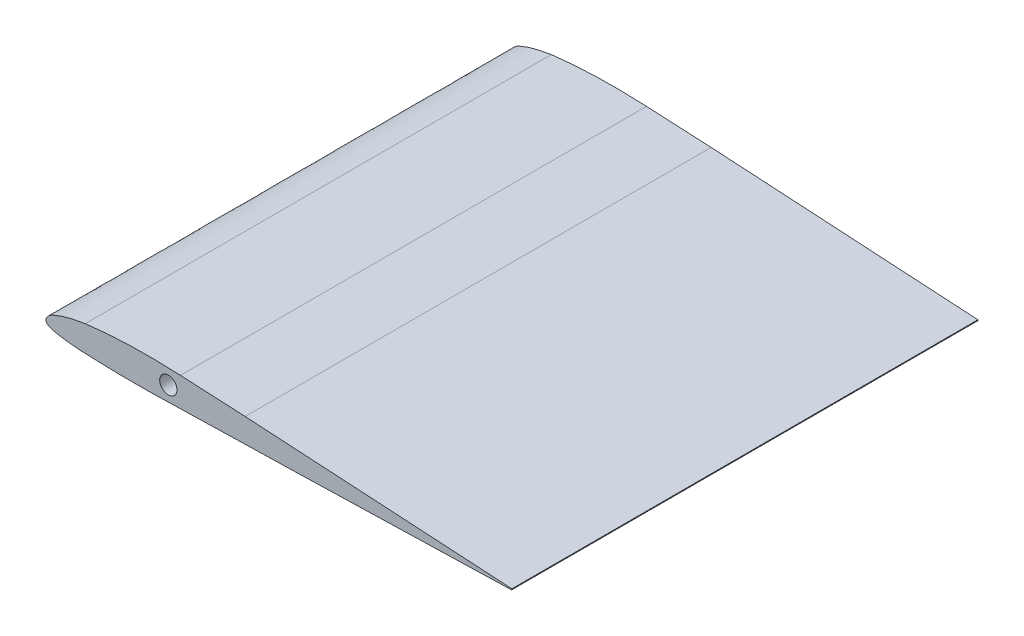
from build123d import *

# Parameters (mm, degrees)
AIRFOIL_DEPTH        = 203.2
CAMERA_CHANNEL_REACH = 289.922
SKETCH8_R            = 3.7592


with BuildPart() as part:
    # Sketch3 → Airfoil (new body)
    with BuildSketch(Plane.XY):
        with BuildLine():
            Line((202.994130812, 8.658655976), (110.583708873, 6.155294174))
            Line((110.583708873, 6.155294174), (45.243748526, 4.547671469))
            add(Edge.make_bspline(
                [(45.243748526, 4.547671469), (38.923572392, 4.568921268), (32.598685078, 4.437436548), (26.283676376, 4.693840567), (22.348358646, 4.853623607), (18.410196386, 4.937297779), (14.474878656, 5.097080819), (14.412947754, 5.099595357), (14.370093626, 5.173356562), (14.308475425, 5.180061537), (13.757234945, 5.240044692), (0.092319138, 5.933082267), (0.001596992, 8.740633601), (-0.083348667, 11.369421688), (3.240638559, 12.597933624), (5.152498304, 13.319770824), (6.702595853, 13.905021952), (8.281848193, 14.426252138), (9.890881707, 14.821641117), (12.262560893, 15.404435574), (14.691150833, 15.883501489), (17.149620686, 16.274957356)],
                knots=[0, 0, 0, 0, 1, 1, 1, 2, 2, 2, 3, 3, 3, 4, 4, 4, 5, 5, 5, 6, 6, 6, 6.272168289, 6.272168289, 6.272168289, 6.272168289], degree=3))
            add(Edge.make_bspline(
                [(17.149620686, 16.274957356), (28.832499255, 17.725653279), (42.670326445, 18.291936138), (58.641329464, 17.491030382)],
                knots=[0, 0, 0, 0, 1, 1, 1, 1], degree=3))
            Line((58.641329464, 17.491030382), (86.846468464, 16.076613382))
            Line((86.846468464, 16.076613382), (160.978559464, 11.666960382))
            Line((160.978559464, 11.666960382), (203.160688074, 9.157810196))
            ThreePointArc((203.160688074, 9.157810196), (203.180787666, 8.873737948), (202.994130812, 8.658655976))
        make_face()
    extrude(amount=AIRFOIL_DEPTH)

    # Sketch8 → Camera Channel (cut, up to next)
    with BuildSketch(Plane(origin=(0, 0, 0), x_dir=(-1, 0, 0), z_dir=(0, 0, -1)), mode=Mode.PRIVATE) as camera_channel_sk1:
        with Locations((-53.34, 11.228365492)):
            Circle(SKETCH8_R)
    camera_channel_tool1 = extrude(camera_channel_sk1.sketch, amount=-CAMERA_CHANNEL_REACH, mode=Mode.PRIVATE) & part.part
    add(camera_channel_tool1.solids().sort_by_distance((53.34, 11.228365, 0))[0], mode=Mode.SUBTRACT)


solid = part.part
